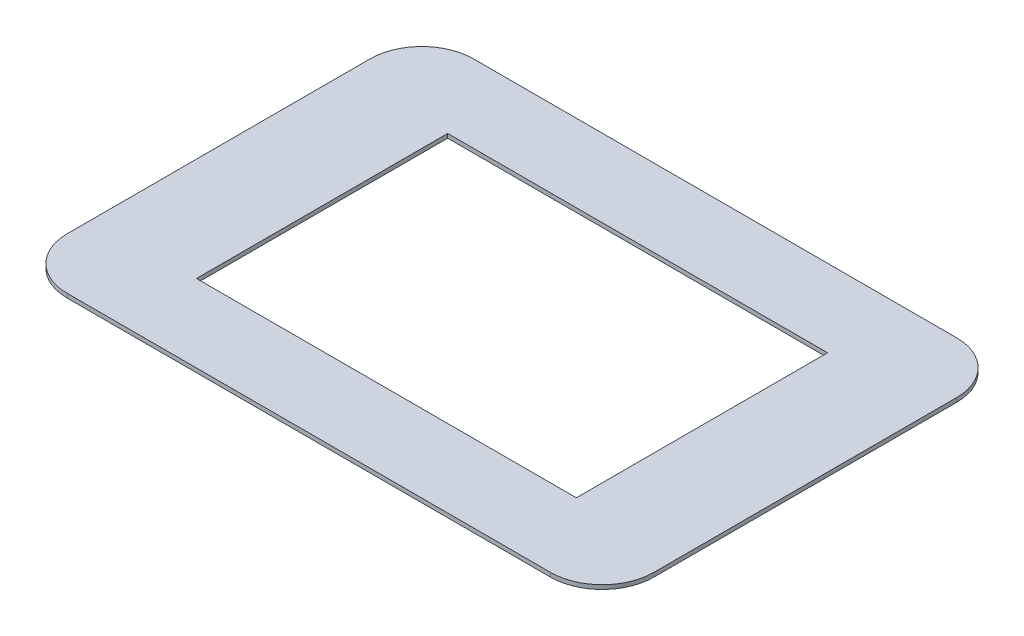
from build123d import *

# Parameters (mm, degrees)
SKETCH_1_W      = 73.5
SKETCH_1_H      = 48.6
EXTRUDE_1_DEPTH = 0.8


with BuildPart() as part:
    # Эскиз1 → Бобышка-Вытянуть1 (new body)
    with BuildSketch(Plane(origin=(0, 0, 0), x_dir=(1, 0, 0), z_dir=(0, 1, 0))):
        with BuildLine():
            Line((10, 0), (103.5, 0))
            ThreePointArc((103.5, 0), (110.571067812, 2.928932188), (113.5, 10))
            Line((113.5, 10), (113.5, 68.6))
            ThreePointArc((113.5, 68.6), (110.571067812, 75.671067812), (103.5, 78.6))
            Line((103.5, 78.6), (10, 78.6))
            ThreePointArc((10, 78.6), (2.928932188, 75.671067812), (0, 68.6))
            Line((0, 68.6), (0, 10))
            ThreePointArc((0, 10), (2.928932188, 2.928932188), (10, 0))
        make_face()
        with Locations((56.75, 39.3)):
            Rectangle(SKETCH_1_W, SKETCH_1_H, mode=Mode.SUBTRACT)
    extrude(amount=EXTRUDE_1_DEPTH)


solid = part.part
